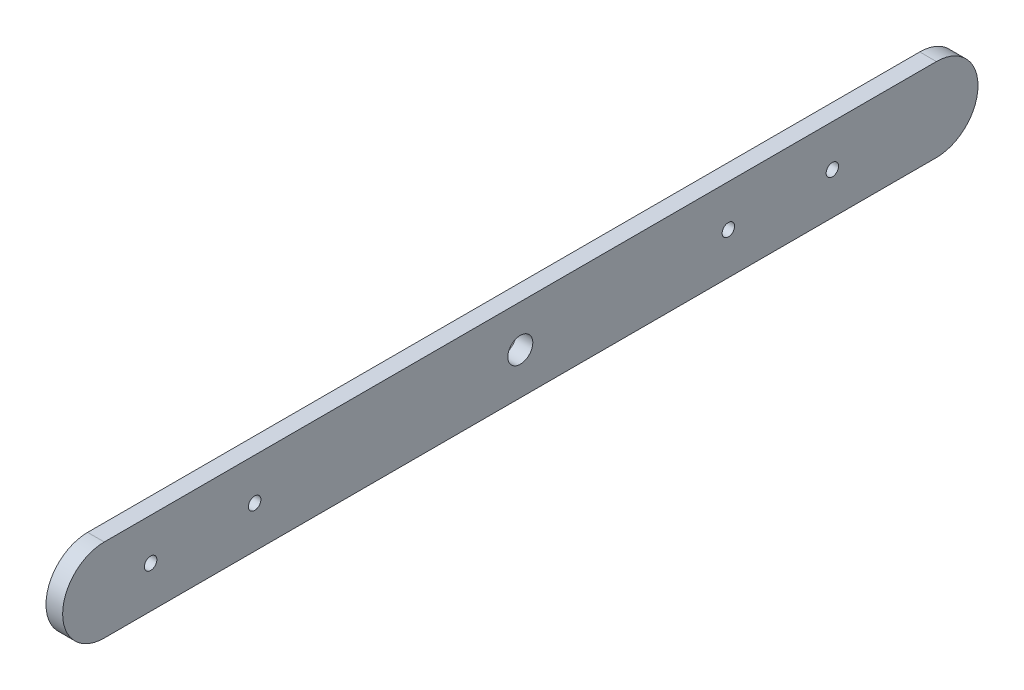
from build123d import *

# Parameters (mm, degrees)
CROQUIS1_R              = 3
SALIENTE_EXTRUIR1_DEPTH = 4
CROQUIS5_R              = 1.5
CORTAR_EXTRUIR4_DEPTH   = 65


with BuildPart() as part:
    # Croquis1 → Saliente-Extruir1 (new body)
    with BuildSketch(Plane(origin=(0, 0, 0), x_dir=(0, 0, -1), z_dir=(1, 0, 0))):
        with BuildLine():
            Line((0, 0), (-104.055250837, 0))
            ThreePointArc((-104.055250837, 0), (-114.055250837, 10), (-104.055250837, 20))
            Line((-104.055250837, 20), (0, 20))
            Line((0, 20), (95.944749163, 20))
            ThreePointArc((95.944749163, 20), (105.944749163, 10), (95.944749163, 0))
            Line((95.944749163, 0), (0, 0))
        make_face()
        with Locations((-4.055250837, 10)):
            Circle(CROQUIS1_R, mode=Mode.SUBTRACT)
    extrude(amount=SALIENTE_EXTRUIR1_DEPTH)

    # Croquis5 → Cortar-Extruir4 (cut)
    with BuildSketch(Plane.ZY):
        with Locations((-70.944749163, 10)):
            Circle(CROQUIS5_R)
        with Locations((-45.944749163, 10)):
            Circle(CROQUIS5_R)
        with Locations(Location((67.905250837, 10, 0), (0, 0, 180))):
            Circle(CROQUIS5_R)
        with Locations(Location((92.905250837, 10, 0), (0, 0, 180))):
            Circle(CROQUIS5_R)
    extrude(amount=-CORTAR_EXTRUIR4_DEPTH, mode=Mode.SUBTRACT)


solid = part.part
